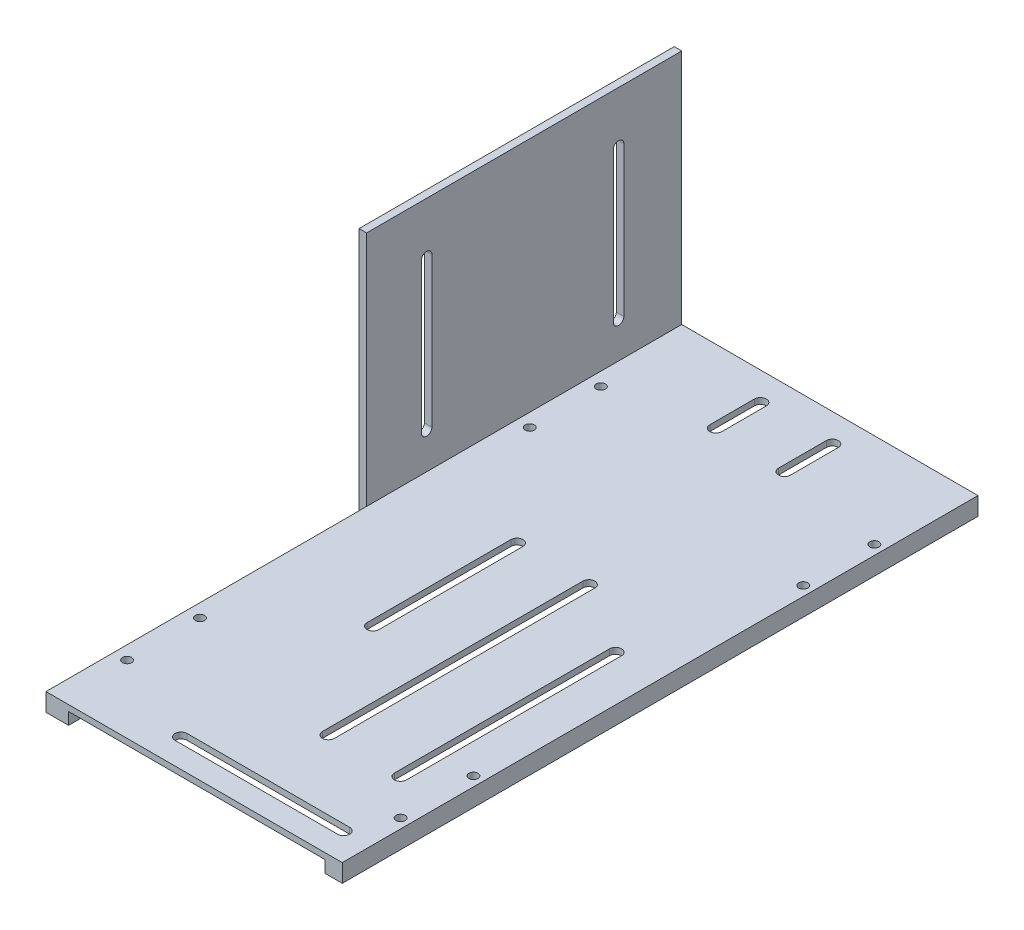
from build123d import *

# Parameters (mm, degrees)
SKETCH_1_R          = 1.525
EXTRUDE_1_DEPTH     = 6
SKETCH_4_W          = 2.5
SKETCH_4_H          = 105.086243491
EXTRUDE_3_DEPTH     = 85
CUT_EXTRUDE_1_DEPTH = 58
SKETCH_5_W          = 85.517137539
SKETCH_5_H          = 212
CUT_EXTRUDE_2_DEPTH = 4


with BuildPart() as part:
    # 草图1 → 凸台-拉伸1 (new body)
    with BuildSketch(Plane(origin=(0, 0, 0), x_dir=(1, 0, 0), z_dir=(0, 1, 0))):
        Polygon((0, 200.086243491), (70.15383623, 200.086243491), (70.15383623, 107.080558208), (70.15383623, -11.913756509), (-28.642514872, -11.913756509), (-28.642514872, 0.086243491), (-28.642514872, 200.086243491), (-10.033645843, 200.086243491), align=None)
        with Locations(Location((-24.222040848, 145, 0), (0, 0, 270))):
            Circle(SKETCH_1_R, mode=Mode.SUBTRACT)
        with Locations(Location((66.977959152, 145, 0), (0, 0, 270))):
            Circle(SKETCH_1_R, mode=Mode.SUBTRACT)
        with Locations(Location((66.977959152, 35, 0), (0, 0, 270))):
            Circle(SKETCH_1_R, mode=Mode.SUBTRACT)
        with Locations(Location((-24.222040848, 35, 0), (0, 0, 270))):
            Circle(SKETCH_1_R, mode=Mode.SUBTRACT)
        with Locations(Location((-24.222040848, 10.701543846, 0), (0, 0, 270))):
            Circle(SKETCH_1_R, mode=Mode.SUBTRACT)
        with Locations(Location((66.977959152, 10.701543846, 0), (0, 0, 270))):
            Circle(SKETCH_1_R, mode=Mode.SUBTRACT)
        with Locations(Location((66.977959152, 168.701543846, 0), (0, 0, 270))):
            Circle(SKETCH_1_R, mode=Mode.SUBTRACT)
        with Locations(Location((-24.222040848, 168.701543846, 0), (0, 0, 270))):
            Circle(SKETCH_1_R, mode=Mode.SUBTRACT)
        with BuildLine():
            Line((61.212367219, -4.489544392), (6.977959152, -4.489544392))
            ThreePointArc((6.977959152, -4.489544392), (4.977959152, -2.489544392), (6.977959152, -0.489544392))
            Line((6.977959152, -0.489544392), (8.977959152, -0.489544392))
            Line((8.977959152, -0.489544392), (28.977959152, -0.489544392))
            Line((28.977959152, -0.489544392), (32.977959152, -0.489544392))
            Line((32.977959152, -0.489544392), (52.977959152, -0.489544392))
            Line((52.977959152, -0.489544392), (56.977959152, -0.489544392))
            Line((56.977959152, -0.489544392), (61.212367219, -0.489544392))
            ThreePointArc((61.212367219, -0.489544392), (63.212367219, -2.489544392), (61.212367219, -4.489544392))
        make_face(mode=Mode.SUBTRACT)
        with BuildLine():
            Line((8.977959152, 109.497464931), (8.977959152, 61.518458116))
            ThreePointArc((8.977959152, 61.518458116), (6.977959152, 59.518458116), (4.977959152, 61.518458116))
            Line((4.977959152, 61.518458116), (4.977959152, 109.497464931))
            ThreePointArc((4.977959152, 109.497464931), (6.977959152, 111.497464931), (8.977959152, 109.497464931))
        make_face(mode=Mode.SUBTRACT)
        with BuildLine():
            Line((4.977959152, 190.683676085), (4.977959152, 175.850262547))
            ThreePointArc((4.977959152, 175.850262547), (6.977959152, 173.850262547), (8.977959152, 175.850262547))
            Line((8.977959152, 175.850262547), (8.977959152, 190.683676085))
            ThreePointArc((8.977959152, 190.683676085), (6.977959152, 192.683676085), (4.977959152, 190.683676085))
        make_face(mode=Mode.SUBTRACT)
        with BuildLine():
            Line((32.977959152, 190.683676085), (32.977959152, 174.729552713))
            ThreePointArc((32.977959152, 174.729552713), (30.977959152, 172.729552713), (28.977959152, 174.729552713))
            Line((28.977959152, 174.729552713), (28.977959152, 190.683676085))
            ThreePointArc((28.977959152, 190.683676085), (30.977959152, 192.683676085), (32.977959152, 190.683676085))
        make_face(mode=Mode.SUBTRACT)
        with BuildLine():
            Line((56.977959152, 94.393526779), (56.977959152, 22.664710655))
            ThreePointArc((56.977959152, 22.664710655), (54.977959152, 20.664710655), (52.977959152, 22.664710655))
            Line((52.977959152, 22.664710655), (52.977959152, 94.393526779))
            ThreePointArc((52.977959152, 94.393526779), (54.977959152, 96.393526779), (56.977959152, 94.393526779))
        make_face(mode=Mode.SUBTRACT)
        with BuildLine():
            Line((28.977959152, 109.497464931), (28.977959152, 22.664710655))
            ThreePointArc((28.977959152, 22.664710655), (30.977959152, 20.664710655), (32.977959152, 22.664710655))
            Line((32.977959152, 22.664710655), (32.977959152, 109.497464931))
            ThreePointArc((32.977959152, 109.497464931), (30.977959152, 111.497464931), (28.977959152, 109.497464931))
        make_face(mode=Mode.SUBTRACT)
    extrude(amount=EXTRUDE_1_DEPTH)

    # 草图4 → 凸台-拉伸3 (add)
    with BuildSketch(Plane.XZ):
        with Locations((-29.892514872, -147.543121746)):
            Rectangle(SKETCH_4_W, SKETCH_4_H)
    extrude(amount=-EXTRUDE_3_DEPTH)

    # 草图3 → 切除-拉伸1 (cut)
    with BuildSketch(Plane(origin=(-28.642514872, 0, 0), x_dir=(0, 0, -1), z_dir=(1, 0, 0))):
        with BuildLine():
            Line((113.273012401, 18), (113.273012401, 67.892967917))
            ThreePointArc((113.273012401, 67.892967917), (115.023012401, 69.642967917), (116.773012401, 67.892967917))
            Line((116.773012401, 67.892967917), (116.773012401, 18))
            ThreePointArc((116.773012401, 18), (115.023012401, 16.25), (113.273012401, 18))
        make_face()
        with BuildLine():
            Line((180.773012401, 18), (180.773012401, 67.892967917))
            ThreePointArc((180.773012401, 67.892967917), (179.023012401, 69.642967917), (177.273012401, 67.892967917))
            Line((177.273012401, 67.892967917), (177.273012401, 18))
            ThreePointArc((177.273012401, 18), (179.023012401, 16.25), (180.773012401, 18))
        make_face()
    extrude(amount=-CUT_EXTRUDE_1_DEPTH, mode=Mode.SUBTRACT)

    # 草图5 → 切除-拉伸2 (cut)
    with BuildSketch(Plane.XZ):
        with Locations((21.659274281, -94.086243491)):
            Rectangle(SKETCH_5_W, SKETCH_5_H)
    extrude(amount=-CUT_EXTRUDE_2_DEPTH, mode=Mode.SUBTRACT)


solid = part.part
